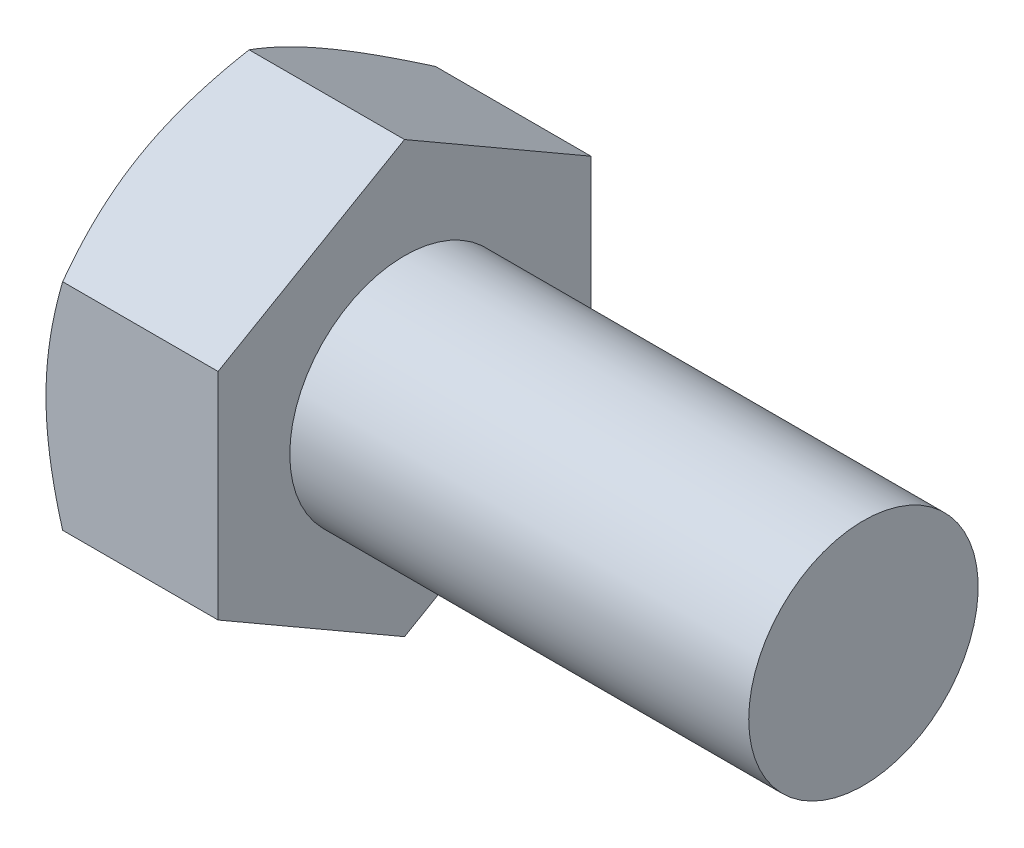
from build123d import *

# Parameters (mm, degrees)
HEX_DIE_START = -1e-06
SKETCH2_R     = 7.580831409
HEX_DIE_DEPTH = 6.000001
SKETCH4_R     = 5.6875
INDENT_DEPTH  = 0.75


with BuildPart() as part:
    # BodySke → Base-Revolve (revolve)
    with BuildSketch(Plane.XY, mode=Mode.PRIVATE) as base_revolve_sk:
        Polygon((6, 4), (6, 7.505773672), (0.5806837, 7.505773672), (0, 6.5), (0, 0), (22, 0), (22, 4), align=None)
    revolve(base_revolve_sk.sketch.rotate(Axis((-25.4, 0, 0), (1, 0, 0)), 90), axis=Axis((-25.4, 0, 0), (1, 0, 0)))

    # Sketch2 → Hex-Die (cut)
    with BuildSketch(Plane(origin=(0, 0, 0), x_dir=(0, 0, -1), z_dir=(1, 0, 0)).offset(HEX_DIE_START)):
        Circle(SKETCH2_R)
        Polygon((-6.5, 3.752776766), (0, 7.505553532), (6.5, 3.752776766), (6.5, -3.752776766), (0, -7.505553532), (-6.5, -3.752776766), align=None, mode=Mode.SUBTRACT)
    extrude(amount=HEX_DIE_DEPTH, mode=Mode.SUBTRACT)

    # Sketch4 → Indent (cut)
    with BuildSketch(Plane(origin=(0, 0, 0), x_dir=(0, 0, -1), z_dir=(1, 0, 0))):
        Circle(SKETCH4_R)
    extrude(amount=INDENT_DEPTH, mode=Mode.SUBTRACT)


solid = part.part
